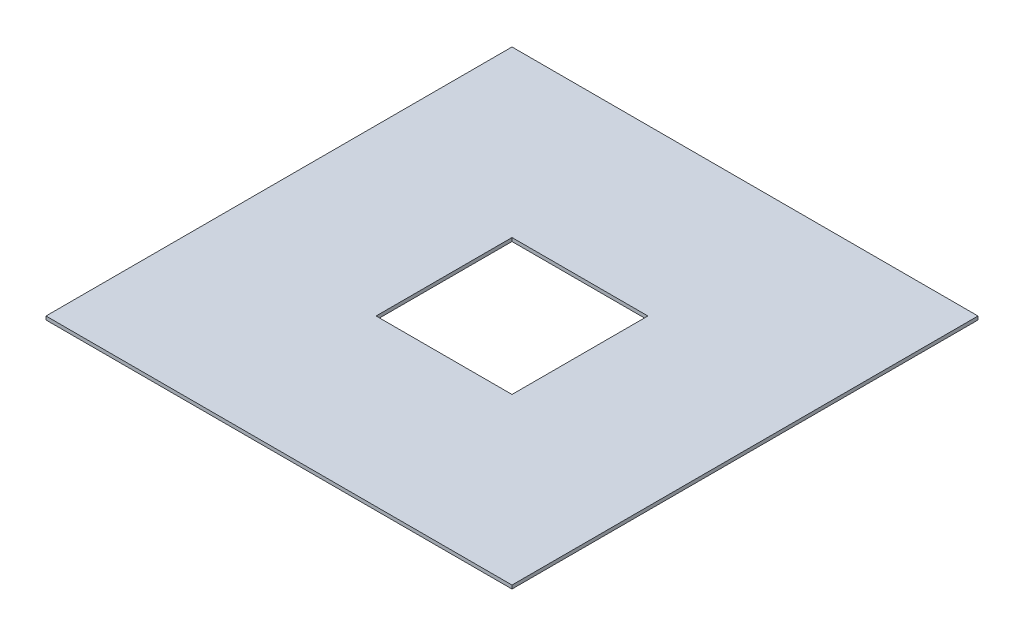
from build123d import *

# Parameters (mm, degrees)
SKETCH1_W           = 2.4
SKETCH1_H           = 2.4
SKETCH1_W_2         = 0.7
SKETCH1_H_2         = 0.7
BOSS_EXTRUDE1_DEPTH = 0.018


with BuildPart() as part:
    # Sketch1 → Boss-Extrude1 (new body)
    with BuildSketch(Plane(origin=(0, 3.23380127, 0), x_dir=(1, 0, 0), z_dir=(0, 1, 0))):
        Rectangle(SKETCH1_W, SKETCH1_H)
        Rectangle(SKETCH1_W_2, SKETCH1_H_2, mode=Mode.SUBTRACT)
    extrude(amount=BOSS_EXTRUDE1_DEPTH)


solid = part.part
